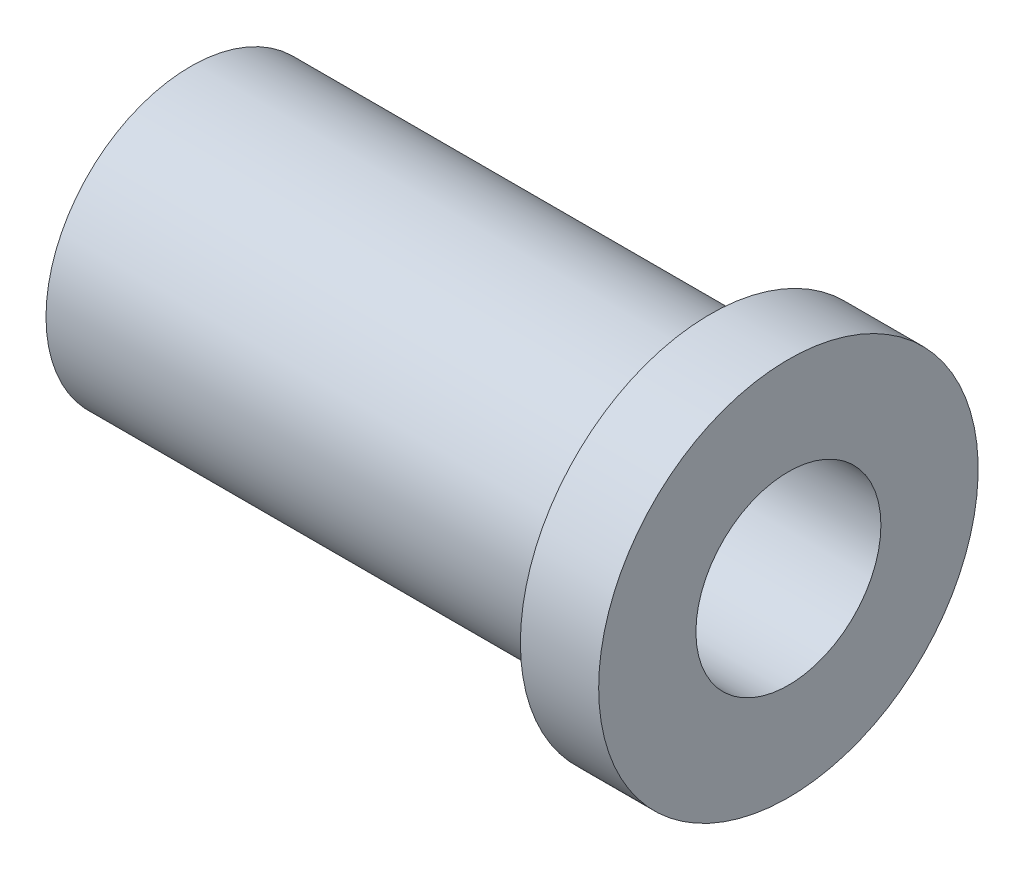
from build123d import *


with BuildPart() as part:
    # Schizzo1 → Rivoluzione1 (revolve)
    with BuildSketch(Plane(origin=(0, 0, 0), x_dir=(1, 0, 0), z_dir=(0, 1, 0)), mode=Mode.PRIVATE) as rivoluzione1_sk:
        with BuildLine():
            Line((0, 3.9), (0, 6.1))
            Line((0, 6.1), (21.7, 6.1))
            ThreePointArc((21.7, 6.1), (21.841421356, 6.158578644), (21.9, 6.3))
            Line((21.9, 6.3), (21.9, 8))
            Line((21.9, 8), (25.2, 8))
            Line((25.2, 8), (25.2, 3.9))
            Line((25.2, 3.9), (0, 3.9))
        make_face()
    revolve(rivoluzione1_sk.sketch.rotate(Axis((-60.499740909, 0, 0), (1, 0, 0)), 180), axis=Axis((-60.499740909, 0, 0), (1, 0, 0)))


solid = part.part
